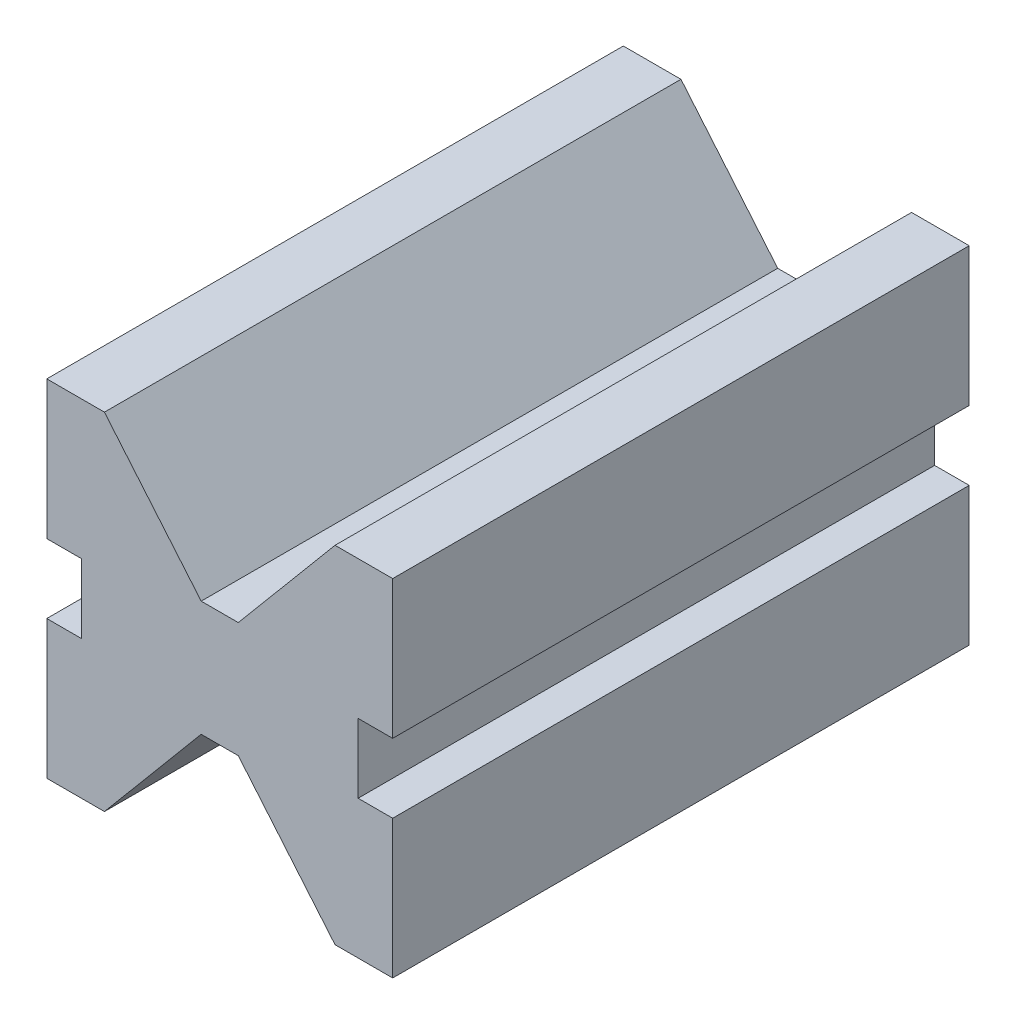
from build123d import *

# Parameters (mm, degrees)
Y_KSEKLIK_EKSTR_ZYON1_DEPTH = 100


with BuildPart() as part:
    # Çizim2 → Yükseklik-Ekstrüzyon1 (new body)
    with BuildSketch(Plane.XY):
        Polygon((-30, 30), (-20, 30), (-3.218007376, 10), (3.218007376, 10), (20, 30), (30, 30), (30, 6), (24, 6), (24, -6), (30, -6), (30, -30), (20, -30), (3.218007376, -10), (-3.218007376, -10), (-20, -30), (-30, -30), (-30, -6), (-24, -6), (-24, 6), (-30, 6), align=None)
    extrude(amount=Y_KSEKLIK_EKSTR_ZYON1_DEPTH)


solid = part.part
